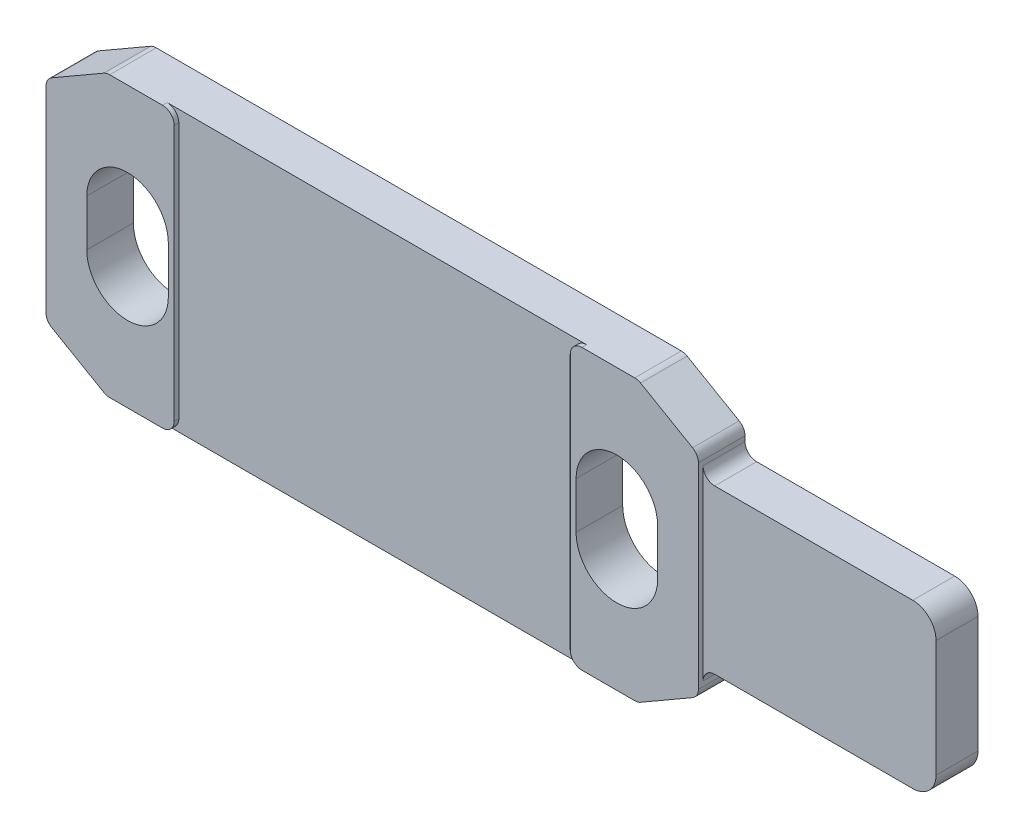
from build123d import *
from OCP.BRepFilletAPI import BRepFilletAPI_MakeChamfer

# Parameters (mm, degrees)
SALIENTE_EXTRUIR1_DEPTH      = 6
SALIENTE_EXTRUIR1_DEPTH_BACK = 6
CROQUIS4_W                   = 38
CROQUIS4_H                   = 2
CROQUIS1_W                   = 10
CROQUIS1_H                   = 2.5
CROQUIS1_R                   = 1.75
CORTAR_EXTRUIR2_DEPTH        = 10
CROQUIS5_W                   = 17
CROQUIS5_H                   = 12
CROQUIS5_W_2                 = 10
CORTAR_EXTRUIR3_DEPTH        = 0.2
REDONDEO1_R                  = 0.5
REDONDEO2_R                  = 0.5
REDONDEO4_R                  = 1
CHAFL_N1_SIZE                = 1.5
CHAFL_N1_SIZE2               = 2.598076211
REDONDEO5_R                  = 0.5


with BuildPart() as part:
    # Croquis4 → Saliente-Extruir1 (new, two sides: drawn at the far end of the back side and taken through both)
    with BuildSketch(Plane(origin=(0, 0, 0), x_dir=(1, 0, 0), z_dir=(0, 1, 0)).offset(-SALIENTE_EXTRUIR1_DEPTH_BACK)):
        with Locations((19, 1)):
            Rectangle(CROQUIS4_W, CROQUIS4_H)
    extrude(amount=SALIENTE_EXTRUIR1_DEPTH + SALIENTE_EXTRUIR1_DEPTH_BACK)

    # Croquis1 → Cortar-Extruir2 (cut)
    with BuildSketch(Plane.XY):
        with Locations((33, 4.75)):
            Rectangle(CROQUIS1_W, CROQUIS1_H)
        with Locations((33, -4.75)):
            Rectangle(CROQUIS1_W, CROQUIS1_H)
        with Locations((24.5, 0)):
            Circle(CROQUIS1_R)
        with Locations((3.5, 0)):
            Circle(CROQUIS1_R)
        with BuildLine():
            Line((1.75, 1), (1.75, -1))
            ThreePointArc((1.75, -1), (3.5, -2.75), (5.25, -1))
            Line((5.25, -1), (5.25, 1))
            ThreePointArc((5.25, 1), (3.5, 2.75), (1.75, 1))
        make_face()
        with BuildLine():
            Line((26.25, -1), (26.25, 1))
            ThreePointArc((26.25, 1), (24.5, 2.75), (22.75, 1))
            Line((22.75, 1), (22.75, -1))
            ThreePointArc((22.75, -1), (24.5, -2.75), (26.25, -1))
        make_face()
    extrude(amount=-CORTAR_EXTRUIR2_DEPTH, mode=Mode.SUBTRACT)

    # Croquis5 → Cortar-Extruir3 (cut)
    with BuildSketch(Plane.XY):
        with Locations((14, 0)):
            Rectangle(CROQUIS5_W, CROQUIS5_H)
        with Locations((33, 0)):
            Rectangle(CROQUIS5_W_2, CROQUIS5_H)
    extrude(amount=-CORTAR_EXTRUIR3_DEPTH, mode=Mode.SUBTRACT)

    # Redondeo1
    redondeo1_edges = [part.edges().sort_by_distance(p)[0] for p in [
        (28, 3.5, -1.1),
        (28, -3.5, -1.1),
    ]]
    fillet(redondeo1_edges, radius=REDONDEO1_R)

    # Redondeo2
    redondeo2_edges = [part.edges().sort_by_distance(p)[0] for p in [
        (22.5, 6, -0.1),
        (22.5, -6, -0.1),
        (5.5, -6, -0.1),
        (5.5, 6, -0.1),
    ]]
    fillet(redondeo2_edges, radius=REDONDEO2_R)

    # Redondeo4
    redondeo4_edges = [part.edges().sort_by_distance(p)[0] for p in [
        (38, 3.5, -1.1),
        (38, -3.5, -1.1),
    ]]
    fillet(redondeo4_edges, radius=REDONDEO4_R)

    # Chaflán1: one chamfer whose edges measure the first distance from different faces: ONE call of the kernel's chamfer builder (chamfer() names one face for all edges)
    chafl_n1_edges_1 = [part.edges().sort_by_distance(p)[0] for p in [
        (0, -6, -1),
        (0, 6, -1),
    ]]
    chafl_n1_side_1 = [part.faces().sort_by_distance(p)[0] for p in [
        (0, 0, -1),
    ]]
    chafl_n1_edges_2 = [part.edges().sort_by_distance(p)[0] for p in [
        (28, 6, -1),
        (28, -6, -1),
    ]]
    chafl_n1_side_2 = [part.faces().sort_by_distance(p)[0] for p in [
        (28, 5, -1.878344749),
    ]]
    chafl_n1 = BRepFilletAPI_MakeChamfer(part.part.solid().wrapped)
    for e in chafl_n1_edges_1:
        chafl_n1.Add(CHAFL_N1_SIZE, CHAFL_N1_SIZE2, e.wrapped, chafl_n1_side_1[0].wrapped)  # the first distance lies on this face
    for e in chafl_n1_edges_2:
        chafl_n1.Add(CHAFL_N1_SIZE, CHAFL_N1_SIZE2, e.wrapped, chafl_n1_side_2[0].wrapped)  # the first distance lies on this face
    add(Compound.cast(chafl_n1.Shape()), mode=Mode.REPLACE)

    # Redondeo5
    redondeo5_edges = [part.edges().sort_by_distance(p)[0] for p in [
        (25.401923789, 6, -1),
        (2.598076211, 6, -1),
        (0, -4.5, -1),
        (0, 4.5, -1),
        (25.401923789, -6, -1),
        (2.598076211, -6, -1),
        (28, -4.5, -1),
        (28, 4.5, -1),
    ]]
    fillet(redondeo5_edges, radius=REDONDEO5_R)


solid = part.part
